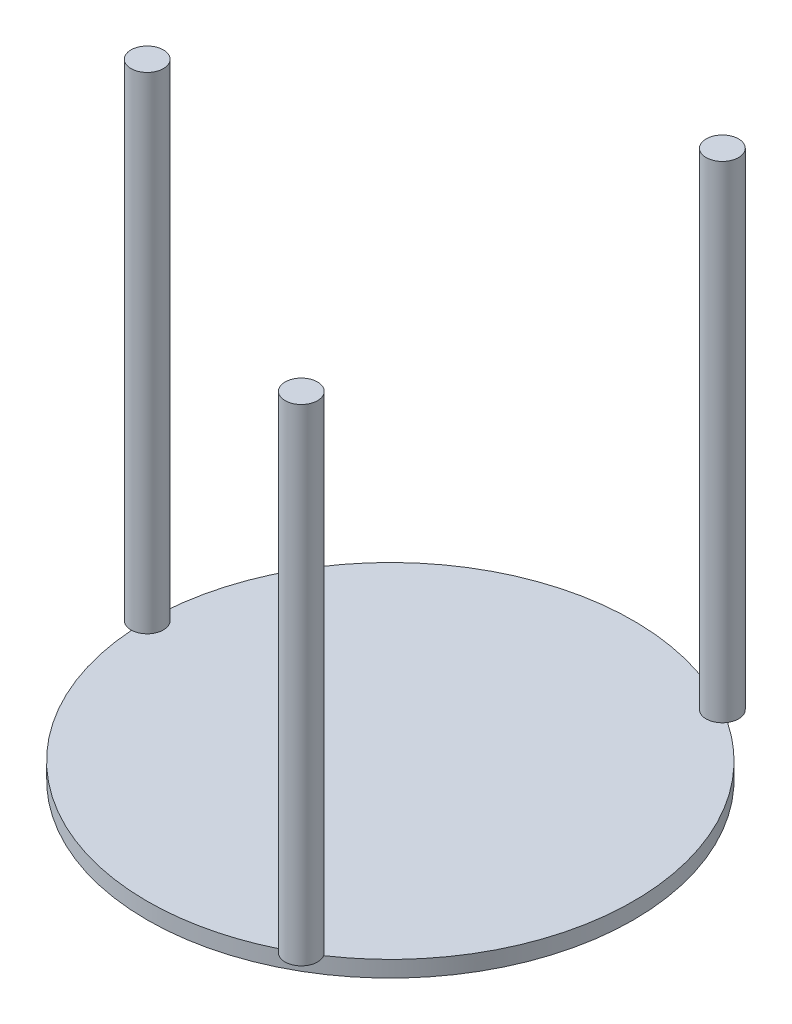
from build123d import *

# Parameters (mm, degrees)
SKETCH1_R             = 10
BOSS_EXTRUDE1_DEPTH   = 300
BOSS_EXTRUDE1_2_DEPTH = 300
BOSS_EXTRUDE1_3_DEPTH = 300
SKETCH1_3_R           = 150
BOSS_EXTRUDE2_DEPTH   = 10


with BuildPart() as part:
    # Sketch1 → Boss-Extrude1 (new body)
    with BuildSketch(Plane(origin=(0, 0, 0), x_dir=(1, 0, 0), z_dir=(0, 1, 0))):
        with Locations((-150, 0)):
            Circle(SKETCH1_R)
    extrude(amount=BOSS_EXTRUDE1_DEPTH)



with BuildPart() as body_2:
    # Sketch1 → Boss-Extrude1 2 (new body)
    with BuildSketch(Plane(origin=(0, 0, 0), x_dir=(1, 0, 0), z_dir=(0, 1, 0))):
        with Locations((75, 129.903810568)):
            Circle(SKETCH1_R)
    extrude(amount=BOSS_EXTRUDE1_2_DEPTH)


with BuildPart() as body_3:
    # Sketch1 → Boss-Extrude1 3 (new body)
    with BuildSketch(Plane(origin=(0, 0, 0), x_dir=(1, 0, 0), z_dir=(0, 1, 0))):
        with Locations((75, -129.903810568)):
            Circle(SKETCH1_R)
    extrude(amount=BOSS_EXTRUDE1_3_DEPTH)


with BuildPart() as part_1:
    add(part.part)

    add(body_2.part)  # Boss-Extrude2 merges body 2

    add(body_3.part)  # Boss-Extrude2 merges body 3
    # Sketch1<3> → Boss-Extrude2 (add)
    with BuildSketch(Plane(origin=(0, 0, 0), x_dir=(1, 0, 0), z_dir=(0, 1, 0))):
        Circle(SKETCH1_3_R)
    extrude(amount=-BOSS_EXTRUDE2_DEPTH)


solid = part_1.part
